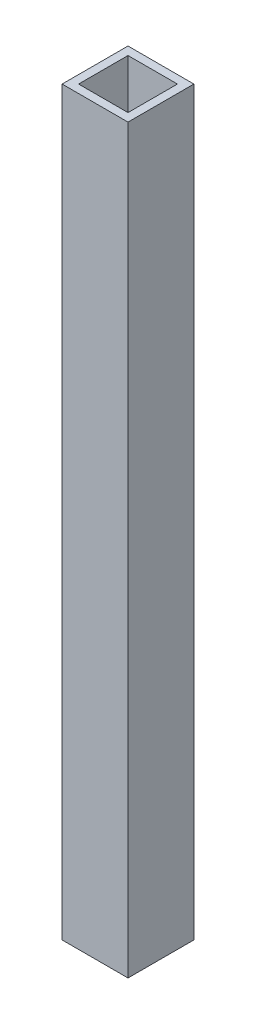
from build123d import *

# Parameters (mm, degrees)
SCHIZZO1_W                   = 40
SCHIZZO1_H                   = 40
SCHIZZO1_W_2                 = 30
SCHIZZO1_H_2                 = 30
ESTRUSIONE_ESTRUSIONE1_DEPTH = 225


with BuildPart() as part:
    # Schizzo1 → Estrusione-Estrusione1 (new, symmetric)
    with BuildSketch(Plane(origin=(0, 0, 0), x_dir=(1, 0, 0), z_dir=(0, 1, 0))):
        Rectangle(SCHIZZO1_W, SCHIZZO1_H)
        Rectangle(SCHIZZO1_W_2, SCHIZZO1_H_2, mode=Mode.SUBTRACT)
    extrude(amount=ESTRUSIONE_ESTRUSIONE1_DEPTH, both=True)


solid = part.part
